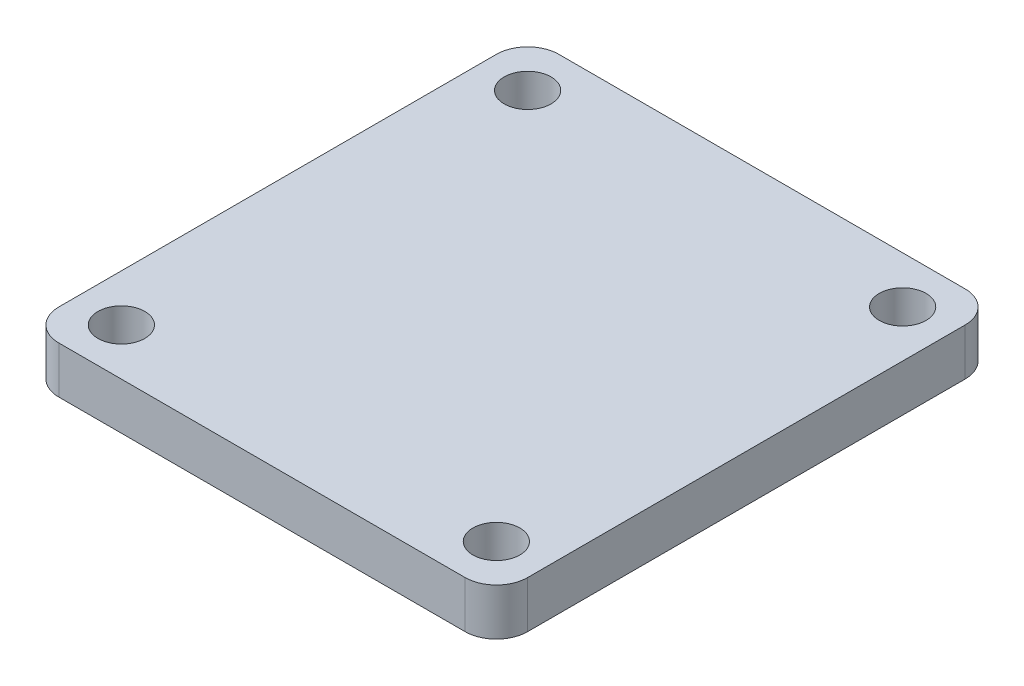
from build123d import *

# Parameters (mm, degrees)
SKETCH_1_W      = 30
SKETCH_1_H      = 32
SKETCH_1_R      = 1.5
EXTRUDE_1_DEPTH = 3
FILLET_1_R      = 2


with BuildPart() as part:
    # 草图1 → 凸台-拉伸1 (new body)
    with BuildSketch(Plane(origin=(0, 0, 0), x_dir=(1, 0, 0), z_dir=(0, 1, 0))):
        Rectangle(SKETCH_1_W, SKETCH_1_H)
        with Locations(Location((12, 13, 0), (0, 0, 270))):
            Circle(SKETCH_1_R, mode=Mode.SUBTRACT)
        with Locations(Location((-12, 13, 0), (0, 0, 90))):
            Circle(SKETCH_1_R, mode=Mode.SUBTRACT)
        with Locations(Location((12, -13, 0), (0, 0, 90))):
            Circle(SKETCH_1_R, mode=Mode.SUBTRACT)
        with Locations(Location((-12, -13, 0), (0, 0, 270))):
            Circle(SKETCH_1_R, mode=Mode.SUBTRACT)
    extrude(amount=EXTRUDE_1_DEPTH)

    # 圆角1
    fillet_1_edges = [part.edges().sort_by_distance(p)[0] for p in [
        (15, 1.5, 16),
        (-15, 1.5, 16),
        (-15, 1.5, -16),
        (15, 1.5, -16),
    ]]
    fillet(fillet_1_edges, radius=FILLET_1_R)


solid = part.part
